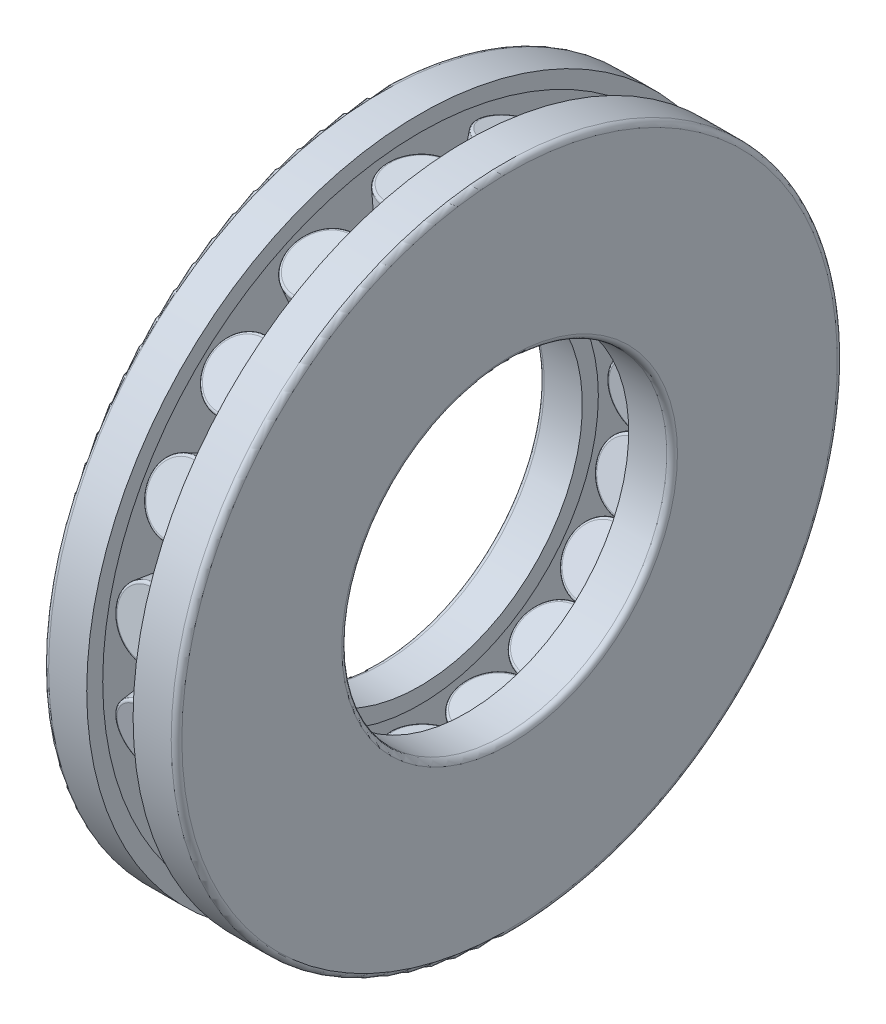
from build123d import *

# Parameters (mm, degrees)
CIRPATTERN1_COUNT = 19


with BuildPart() as part:
    # Sketch1 → Revolve1 (revolve)
    with BuildSketch(Plane(origin=(0, 0, 0), x_dir=(1, 0, 0), z_dir=(0, 1, 0)), mode=Mode.PRIVATE) as revolve1_sk:
        with BuildLine():
            Line((6.35, 62.5), (4.35, 62.5))
            Line((4.35, 62.5), (4.35, 59.5))
            Line((4.35, 59.5), (6.35, 59.5))
            Line((6.35, 59.5), (6.35, 33.5))
            Line((6.35, 33.5), (4.35, 33.5))
            Line((4.35, 33.5), (4.35, 30.5))
            Line((4.35, 30.5), (6.35, 30.5))
            Line((6.35, 30.5), (11.5, 30.5))
            ThreePointArc((11.5, 30.5), (12.207106781, 30.792893219), (12.5, 31.5))
            Line((12.5, 31.5), (12.5, 61.5))
            ThreePointArc((12.5, 61.5), (12.207106781, 62.207106781), (11.5, 62.5))
            Line((11.5, 62.5), (6.35, 62.5))
        make_face()
        with BuildLine():
            Line((-6.35, 59.5), (-6.35, 33.5))
            Line((-6.35, 33.5), (-4.35, 33.5))
            Line((-4.35, 33.5), (-4.35, 30.5))
            Line((-4.35, 30.5), (-6.35, 30.5))
            Line((-6.35, 30.5), (-11.5, 30.5))
            ThreePointArc((-11.5, 30.5), (-12.207106781, 30.792893219), (-12.5, 31.5))
            Line((-12.5, 31.5), (-12.5, 61.5))
            ThreePointArc((-12.5, 61.5), (-12.207106781, 62.207106781), (-11.5, 62.5))
            Line((-11.5, 62.5), (-6.35, 62.5))
            Line((-6.35, 62.5), (-4.35, 62.5))
            Line((-4.35, 62.5), (-4.35, 59.5))
            Line((-4.35, 59.5), (-6.35, 59.5))
        make_face()
    revolve(revolve1_sk.sketch.rotate(Axis((0, 0, 0), (1, 0, 0)), 180), axis=Axis((0, 0, 0), (1, 0, 0)))


with BuildPart() as body_2:
    # Sketch3 → Revolve2 (revolve)
    with BuildSketch(Plane(origin=(0, 0, 0), x_dir=(1, 0, 0), z_dir=(0, 1, 0))):
        with BuildLine():
            Line((0, 36.875), (5.75, 36.875))
            ThreePointArc((5.75, 36.875), (6.103553391, 37.021446609), (6.25, 37.375))
            Line((6.25, 37.375), (6.25, 55.625))
            ThreePointArc((6.25, 55.625), (6.103553391, 55.978553391), (5.75, 56.125))
            Line((5.75, 56.125), (0, 56.125))
            Line((0, 56.125), (0, 36.875))
        make_face()
    revolve(axis=Axis((0, 0, -36.875), (0, 0, -1)))


with BuildPart() as cirpattern1_1:
    # CirPattern1: pattern copy
    add(body_2.part.rotate(Axis((0, 0, 0), (1, 0, 0)), 1 * 360 / CIRPATTERN1_COUNT))


with BuildPart() as cirpattern1_2:
    # CirPattern1: pattern copy
    add(body_2.part.rotate(Axis((0, 0, 0), (1, 0, 0)), 2 * 360 / CIRPATTERN1_COUNT))


with BuildPart() as cirpattern1_3:
    # CirPattern1: pattern copy
    add(body_2.part.rotate(Axis((0, 0, 0), (1, 0, 0)), 3 * 360 / CIRPATTERN1_COUNT))


with BuildPart() as cirpattern1_4:
    # CirPattern1: pattern copy
    add(body_2.part.rotate(Axis((0, 0, 0), (1, 0, 0)), 4 * 360 / CIRPATTERN1_COUNT))


with BuildPart() as cirpattern1_5:
    # CirPattern1: pattern copy
    add(body_2.part.rotate(Axis((0, 0, 0), (1, 0, 0)), 5 * 360 / CIRPATTERN1_COUNT))


with BuildPart() as cirpattern1_6:
    # CirPattern1: pattern copy
    add(body_2.part.rotate(Axis((0, 0, 0), (1, 0, 0)), 6 * 360 / CIRPATTERN1_COUNT))


with BuildPart() as cirpattern1_7:
    # CirPattern1: pattern copy
    add(body_2.part.rotate(Axis((0, 0, 0), (1, 0, 0)), 7 * 360 / CIRPATTERN1_COUNT))


with BuildPart() as cirpattern1_8:
    # CirPattern1: pattern copy
    add(body_2.part.rotate(Axis((0, 0, 0), (1, 0, 0)), 8 * 360 / CIRPATTERN1_COUNT))


with BuildPart() as cirpattern1_9:
    # CirPattern1: pattern copy
    add(body_2.part.rotate(Axis((0, 0, 0), (1, 0, 0)), 9 * 360 / CIRPATTERN1_COUNT))


with BuildPart() as cirpattern1_10:
    # CirPattern1: pattern copy
    add(body_2.part.rotate(Axis((0, 0, 0), (1, 0, 0)), 10 * 360 / CIRPATTERN1_COUNT))


with BuildPart() as cirpattern1_11:
    # CirPattern1: pattern copy
    add(body_2.part.rotate(Axis((0, 0, 0), (1, 0, 0)), 11 * 360 / CIRPATTERN1_COUNT))


with BuildPart() as cirpattern1_12:
    # CirPattern1: pattern copy
    add(body_2.part.rotate(Axis((0, 0, 0), (1, 0, 0)), 12 * 360 / CIRPATTERN1_COUNT))


with BuildPart() as cirpattern1_13:
    # CirPattern1: pattern copy
    add(body_2.part.rotate(Axis((0, 0, 0), (1, 0, 0)), 13 * 360 / CIRPATTERN1_COUNT))


with BuildPart() as cirpattern1_14:
    # CirPattern1: pattern copy
    add(body_2.part.rotate(Axis((0, 0, 0), (1, 0, 0)), 14 * 360 / CIRPATTERN1_COUNT))


with BuildPart() as cirpattern1_15:
    # CirPattern1: pattern copy
    add(body_2.part.rotate(Axis((0, 0, 0), (1, 0, 0)), 15 * 360 / CIRPATTERN1_COUNT))


with BuildPart() as cirpattern1_16:
    # CirPattern1: pattern copy
    add(body_2.part.rotate(Axis((0, 0, 0), (1, 0, 0)), 16 * 360 / CIRPATTERN1_COUNT))


with BuildPart() as cirpattern1_17:
    # CirPattern1: pattern copy
    add(body_2.part.rotate(Axis((0, 0, 0), (1, 0, 0)), 17 * 360 / CIRPATTERN1_COUNT))


with BuildPart() as cirpattern1_18:
    # CirPattern1: pattern copy
    add(body_2.part.rotate(Axis((0, 0, 0), (1, 0, 0)), 18 * 360 / CIRPATTERN1_COUNT))


solid = Compound([part.part, body_2.part, cirpattern1_1.part, cirpattern1_2.part, cirpattern1_3.part, cirpattern1_4.part, cirpattern1_5.part, cirpattern1_6.part, cirpattern1_7.part, cirpattern1_8.part, cirpattern1_9.part, cirpattern1_10.part, cirpattern1_11.part, cirpattern1_12.part, cirpattern1_13.part, cirpattern1_14.part, cirpattern1_15.part, cirpattern1_16.part, cirpattern1_17.part, cirpattern1_18.part])
